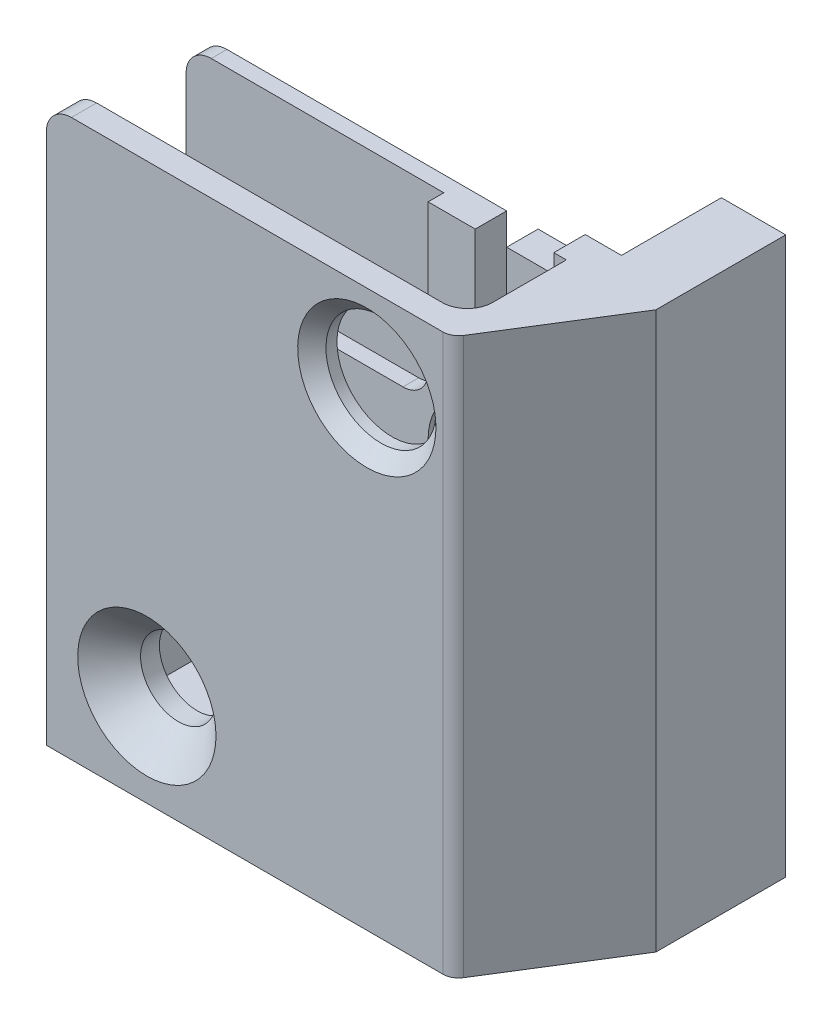
from build123d import *

# Parameters (mm, degrees)
BOSS_EXTRUDE1_DEPTH                             = 15.4
CUT_EXTRUDE2_REACH                              = 25.978
SKETCH3_W                                       = 7.5
SKETCH3_H                                       = 11.5
BOSS_EXTRUDE3_REACH                             = 25.978
SKETCH4_W                                       = 0.8
SKETCH4_H                                       = 6.2
SKETCH4_W_2                                     = 2.8
SKETCH4_H_2                                     = 17.7
SKETCH10_W                                      = 4
SKETCH10_H                                      = 1
CUT_EXTRUDE4_DEPTH                              = 16.3
BOSS_EXTRUDE4_DEPTH                             = 0.8
CSK_FOR_M2_FLAT_HEAD_MACHINE_SCREW3_D           = 2.4
CSK_FOR_M2_FLAT_HEAD_MACHINE_SCREW3_CSINK_D     = 4.4
CSK_FOR_M2_FLAT_HEAD_MACHINE_SCREW3_CSINK_ANGLE = 90
MOVE_FACE1_BY                                   = 0.6
SKETCH3_2_W                                     = 7.5
SKETCH3_2_H                                     = 11.5
BOSS_EXTRUDE6_DEPTH                             = 0.8
CHAMFER1_SIZE                                   = 2.5
CHAMFER1_SIZE2                                  = 4
SKETCH12_W                                      = 2.0475
SKETCH12_H                                      = 3.18
BOSS_EXTRUDE5_DEPTH                             = 17.7
SKETCH11_R                                      = 1.75
CUT_EXTRUDE5_DEPTH                              = 25.580050854
BOSS_EXTRUDE7_DEPTH                             = 1
SKETCH16_W                                      = 8.2
SKETCH16_H                                      = 5.5
CUT_EXTRUDE6_DEPTH                              = 0.5
FILLET5_R                                       = 0.5
FILLET6_R                                       = 0.8


with BuildPart() as part:
    # Sketch2 → Boss-Extrude1 (new body)
    with BuildSketch(Plane(origin=(0, 0, 0), x_dir=(0, 0, -1), z_dir=(1, 0, 0))):
        Polygon((0, 0), (-4.95, 0), (-4.95, 17.7), (-4.15, 17.7), (-4.15, 0.8), (-1, 0.8), (-1, 17.7), (0, 17.7), align=None)
    extrude(amount=BOSS_EXTRUDE1_DEPTH)

    # Sketch3 → Cut-Extrude2 (cut, up to next)
    with BuildSketch(Plane.XY.offset(4.95), mode=Mode.PRIVATE) as cut_extrude2_sk1:
        with Locations((3.75, 11.95)):
            Rectangle(SKETCH3_W, SKETCH3_H)
    cut_extrude2_tool1 = extrude(cut_extrude2_sk1.sketch, amount=-CUT_EXTRUDE2_REACH, mode=Mode.PRIVATE) & part.part
    add(cut_extrude2_tool1.solids().sort_by_distance((3.75, 11.95, 4.95))[0], mode=Mode.SUBTRACT)

    # Sketch4 → Boss-Extrude3 (add, up to next)
    with BuildSketch(Plane.XY.offset(4.95), mode=Mode.PRIVATE) as boss_extrude3_sk1:
        with Locations((0.4, 3.1)):
            Rectangle(SKETCH4_W, SKETCH4_H)
    boss_extrude3_tool1 = extrude(boss_extrude3_sk1.sketch, amount=-BOSS_EXTRUDE3_REACH, mode=Mode.PRIVATE) - part.part
    # Sketch4 → Boss-Extrude3 (add, up to next)
    with BuildSketch(Plane.XY.offset(4.95), mode=Mode.PRIVATE) as boss_extrude3_sk2:
        with Locations((14, 8.85)):
            Rectangle(SKETCH4_W_2, SKETCH4_H_2)
    boss_extrude3_tool2 = extrude(boss_extrude3_sk2.sketch, amount=-BOSS_EXTRUDE3_REACH, mode=Mode.PRIVATE) - part.part
    add(boss_extrude3_tool1.solids().sort_by_distance((0.4, 3.1, 4.95))[0])
    add(boss_extrude3_tool2.solids().sort_by_distance((14, 8.85, 4.95))[0])

    # Sketch10 → Cut-Extrude4 (cut)
    with BuildSketch(Plane(origin=(0, 17.7, 0), x_dir=(1, 0, 0), z_dir=(0, 1, 0))):
        with Locations((10.2, -0.5)):
            Rectangle(SKETCH10_W, SKETCH10_H)
    extrude(amount=-CUT_EXTRUDE4_DEPTH, mode=Mode.SUBTRACT)

    # Sketch6 → Boss-Extrude4 (add)
    with BuildSketch(Plane(origin=(0, 0, 4.15), x_dir=(-1, 0, 0), z_dir=(0, 0, -1))):
        with BuildLine():
            Line((-0.8, 0.8), (-5.05, 0.8))
            Line((-5.05, 0.8), (-5.05, 2.95))
            ThreePointArc((-5.05, 2.95), (-4.508147545, 4.258147545), (-3.2, 4.8))
            Line((-3.2, 4.8), (-0.8, 4.8))
            Line((-0.8, 4.8), (-0.8, 0.8))
        make_face()
    extrude(amount=BOSS_EXTRUDE4_DEPTH)

    # CSK for M2 Flat Head Machine Screw3 (through all)
    with Locations(Plane(origin=(10.2, 14.95, 4.95), x_dir=(0, 1, 0), z_dir=(0, 0, 1))):
        with Locations((0, 0), (-12, 7)):
            CounterSinkHole(CSK_FOR_M2_FLAT_HEAD_MACHINE_SCREW3_D / 2, CSK_FOR_M2_FLAT_HEAD_MACHINE_SCREW3_CSINK_D / 2, counter_sink_angle=CSK_FOR_M2_FLAT_HEAD_MACHINE_SCREW3_CSINK_ANGLE)

    # Move Face1: a face moved inward by 0.6
    extrude(part.faces().sort_by_distance((4.1, 17.7, 0.5))[0], amount=MOVE_FACE1_BY, dir=(0, -1, 0), mode=Mode.SUBTRACT)

    # Sketch3<2> → Boss-Extrude6 (add)
    with BuildSketch(Plane.XY.offset(4.95)):
        with Locations((3.75, 11.95)):
            Rectangle(SKETCH3_2_W, SKETCH3_2_H)
    extrude(amount=-BOSS_EXTRUDE6_DEPTH)

    # Chamfer1
    chamfer1_edges = [part.edges().sort_by_distance(p)[0] for p in [
        (15.4, 8.85, 4.95),
    ]]
    chamfer1_side = [part.faces().sort_by_distance(p)[0] for p in [
        (7.825575812, 8.837442419, 4.95),
    ]]
    chamfer(chamfer1_edges, length=CHAMFER1_SIZE, length2=CHAMFER1_SIZE2, reference=chamfer1_side[0])

    # Sketch12 → Boss-Extrude5 (add)
    with BuildSketch(Plane(origin=(0, 17.7, 0), x_dir=(1, 0, 0), z_dir=(0, 1, 0))):
        with Locations((14.37625, 1.59)):
            Rectangle(SKETCH12_W, SKETCH12_H)
    extrude(amount=-BOSS_EXTRUDE5_DEPTH)

    # Sketch11 → Cut-Extrude5 (cut, through all)
    with BuildSketch(Plane(origin=(0, 0, 4.15), x_dir=(-1, 0, 0), z_dir=(0, 0, -1))):
        with Locations(Location((-10.2, 14.95, 0), (0, 0, 90))):
            Circle(SKETCH11_R)
    extrude(amount=-CUT_EXTRUDE5_DEPTH, mode=Mode.SUBTRACT)

    # Sketch14 → Boss-Extrude7 (add)
    with BuildSketch(Plane(origin=(0, 0, 0), x_dir=(-1, 0, 0), z_dir=(0, 0, -1))):
        with BuildLine():
            Line((-12.2, 17.1), (-12.2, 10.55))
            ThreePointArc((-12.2, 10.55), (-11.78113883, 11.774744871), (-10.7, 12.486491673))
            Line((-10.7, 12.486491673), (-10.7, 17.1))
            Line((-10.7, 17.1), (-12.2, 17.1))
        make_face()
        with BuildLine():
            ThreePointArc((-9.7, 12.486491673), (-8.61886117, 11.774744871), (-8.2, 10.55))
            Line((-8.2, 10.55), (-8.2, 17.1))
            Line((-8.2, 17.1), (-9.7, 17.1))
            Line((-9.7, 17.1), (-9.7, 12.486491673))
        make_face()
    extrude(amount=-BOSS_EXTRUDE7_DEPTH)

    # Sketch16 → Cut-Extrude6 (cut)
    with BuildSketch(Plane.XY.offset(1)):
        with Locations((4.1, 14.35)):
            Rectangle(SKETCH16_W, SKETCH16_H)
    extrude(amount=-CUT_EXTRUDE6_DEPTH, mode=Mode.SUBTRACT)

    # Fillet5
    fillet5_edges = [part.edges().sort_by_distance(p)[0] for p in [
        (12.9, 8.85, 4.95),
    ]]
    fillet(fillet5_edges, radius=FILLET5_R)

    # Fillet6
    fillet6_edges = [part.edges().sort_by_distance(p)[0] for p in [
        (0.8, 5.5, 4.15),
        (0, 17.1, 0.25),
        (0, 17.7, 4.55),
        (0.4, 6.2, 4.15),
        (8.2, 11.6, 0.75),
        (0.4, 6.2, 1),
        (12.6, 9.25, 4.15),
    ]]
    fillet(fillet6_edges, radius=FILLET6_R)


solid = part.part
